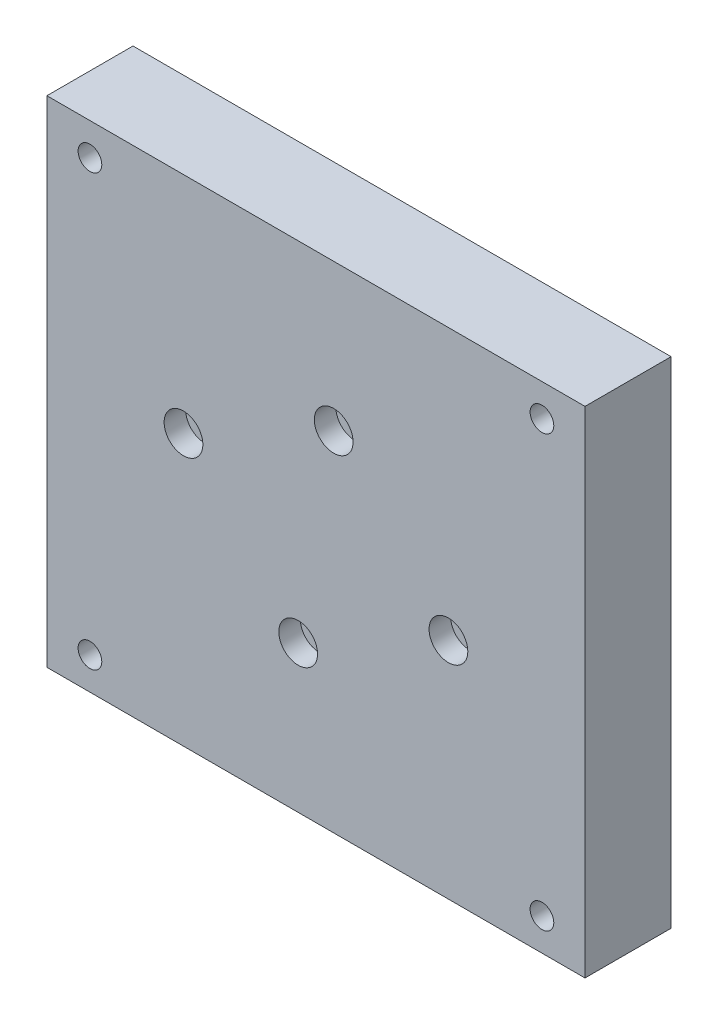
from build123d import *

# Parameters (mm, degrees)
SKETCH_1_W          = 50
SKETCH_1_H          = 46
EXTRUDE_1_DEPTH     = 8
SKETCH_2_R          = 1.025
CUT_EXTRUDE_1_DEPTH = 5
SKETCH_3_R          = 1.8
CUT_EXTRUDE_2_DEPTH = 2
SKETCH_4_R          = 1.1
CUT_EXTRUDE_3_DEPTH = 24


with BuildPart() as part:
    # 草图1 → 凸台-拉伸1 (new body)
    with BuildSketch(Plane.XY):
        Rectangle(SKETCH_1_W, SKETCH_1_H)
    extrude(amount=EXTRUDE_1_DEPTH)

    # 草图2 → 切除-拉伸1 (cut)
    with BuildSketch(Plane.XY.offset(8)):
        with Locations((-1.649657688, -9.355673654)):
            Circle(SKETCH_2_R)
        with Locations((12.310096913, -2.170602221)):
            Circle(SKETCH_2_R)
        with Locations((1.649657688, 9.355673654)):
            Circle(SKETCH_2_R)
        with Locations((-12.310096913, 2.170602221)):
            Circle(SKETCH_2_R)
    extrude(amount=-CUT_EXTRUDE_1_DEPTH, mode=Mode.SUBTRACT)

    # 草图3 → 切除-拉伸2 (cut)
    with BuildSketch(Plane.XY.offset(8)):
        with Locations((-12.310096913, 2.170602221)):
            Circle(SKETCH_3_R)
        with Locations((1.649657688, 9.355673654)):
            Circle(SKETCH_3_R)
        with Locations((12.310096913, -2.170602221)):
            Circle(SKETCH_3_R)
        with Locations((-1.649657688, -9.355673654)):
            Circle(SKETCH_3_R)
    extrude(amount=-CUT_EXTRUDE_2_DEPTH, mode=Mode.SUBTRACT)

    # 草图4 → 切除-拉伸3 (cut)
    with BuildSketch(Plane(origin=(0, 0, 0), x_dir=(-1, 0, 0), z_dir=(0, 0, -1))):
        with Locations((21, -20)):
            Circle(SKETCH_4_R)
        with Locations((-21, -20)):
            Circle(SKETCH_4_R)
    cut_extrude_3 = extrude(amount=-CUT_EXTRUDE_3_DEPTH, mode=Mode.SUBTRACT)

    # 镜向1: 切除-拉伸3 across plane
    add(cut_extrude_3.mirror(Plane(origin=(0, 0, 0), x_dir=(0, 0, 1), z_dir=(0, -1, 0))), mode=Mode.SUBTRACT)


solid = part.part
